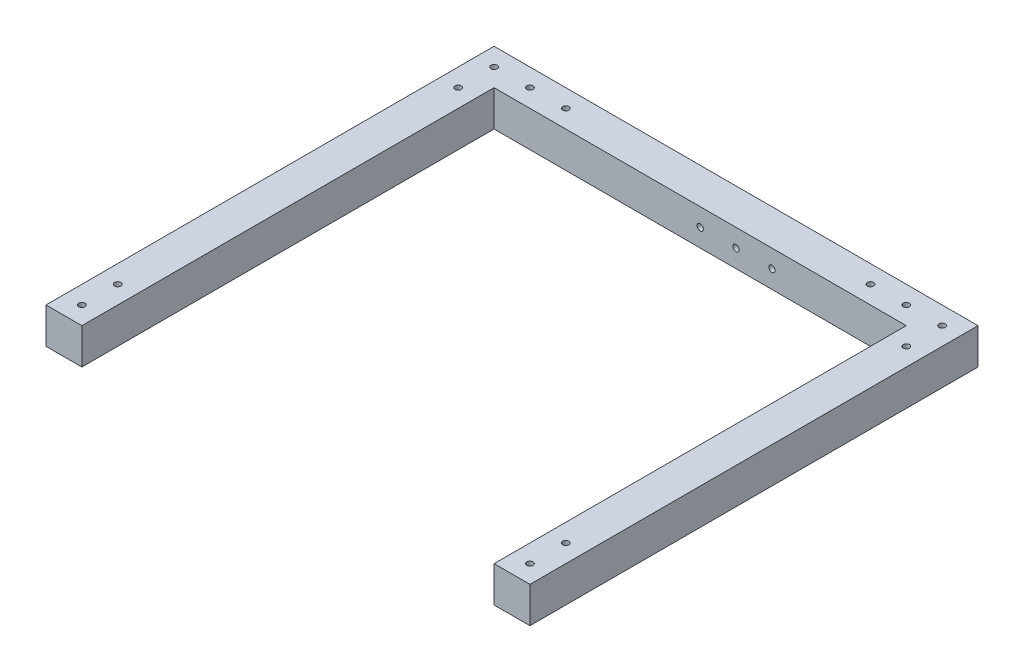
from build123d import *

# Parameters (mm, degrees)
SKETCH_1_W          = 270
SKETCH_1_H          = 20
SKETCH_1_W_2        = 20
SKETCH_1_H_2        = 230
EXTRUDE_1_DEPTH     = 20
CUT_EXTRUDE_1_REACH = 278.089
SKETCH_2_R          = 1.75
CUT_EXTRUDE_2_REACH = 286.825
SKETCH_3_R          = 1.75


with BuildPart() as part:
    # 草图1 → 凸台-拉伸1 (new body)
    with BuildSketch(Plane(origin=(0, 0, 0), x_dir=(1, 0, 0), z_dir=(0, 1, 0))):
        Rectangle(SKETCH_1_W, SKETCH_1_H)
        with Locations((-125, -125)):
            Rectangle(SKETCH_1_W_2, SKETCH_1_H_2)
        with Locations((125, -125)):
            Rectangle(SKETCH_1_W_2, SKETCH_1_H_2)
    extrude(amount=EXTRUDE_1_DEPTH)

    # 草图2 → 切除-拉伸1 (cut, up to next)
    with BuildSketch(Plane(origin=(0, 20, 0), x_dir=(1, 0, 0), z_dir=(0, 1, 0)), mode=Mode.PRIVATE) as cut_extrude_1_sk1:
        with Locations(Location((-125, 0, 0), (0, 0, 270))):
            Circle(SKETCH_2_R)
    cut_extrude_1_tool1 = extrude(cut_extrude_1_sk1.sketch, amount=-CUT_EXTRUDE_1_REACH, mode=Mode.PRIVATE) & part.part
    # 草图2 → 切除-拉伸1 (cut, up to next)
    with BuildSketch(Plane(origin=(0, 20, 0), x_dir=(1, 0, 0), z_dir=(0, 1, 0)), mode=Mode.PRIVATE) as cut_extrude_1_sk2:
        with Locations(Location((-125, -20, 0), (0, 0, 270))):
            Circle(SKETCH_2_R)
    cut_extrude_1_tool2 = extrude(cut_extrude_1_sk2.sketch, amount=-CUT_EXTRUDE_1_REACH, mode=Mode.PRIVATE) & part.part
    # 草图2 → 切除-拉伸1 (cut, up to next)
    with BuildSketch(Plane(origin=(0, 20, 0), x_dir=(1, 0, 0), z_dir=(0, 1, 0)), mode=Mode.PRIVATE) as cut_extrude_1_sk3:
        with Locations(Location((-105, 0, 0), (0, 0, 270))):
            Circle(SKETCH_2_R)
    cut_extrude_1_tool3 = extrude(cut_extrude_1_sk3.sketch, amount=-CUT_EXTRUDE_1_REACH, mode=Mode.PRIVATE) & part.part
    # 草图2 → 切除-拉伸1 (cut, up to next)
    with BuildSketch(Plane(origin=(0, 20, 0), x_dir=(1, 0, 0), z_dir=(0, 1, 0)), mode=Mode.PRIVATE) as cut_extrude_1_sk4:
        with Locations(Location((-125, -210, 0), (0, 0, 270))):
            Circle(SKETCH_2_R)
    cut_extrude_1_tool4 = extrude(cut_extrude_1_sk4.sketch, amount=-CUT_EXTRUDE_1_REACH, mode=Mode.PRIVATE) & part.part
    # 草图2 → 切除-拉伸1 (cut, up to next)
    with BuildSketch(Plane(origin=(0, 20, 0), x_dir=(1, 0, 0), z_dir=(0, 1, 0)), mode=Mode.PRIVATE) as cut_extrude_1_sk5:
        with Locations(Location((-125, -230, 0), (0, 0, 270))):
            Circle(SKETCH_2_R)
    cut_extrude_1_tool5 = extrude(cut_extrude_1_sk5.sketch, amount=-CUT_EXTRUDE_1_REACH, mode=Mode.PRIVATE) & part.part
    # 草图2 → 切除-拉伸1 (cut, up to next)
    with BuildSketch(Plane(origin=(0, 20, 0), x_dir=(1, 0, 0), z_dir=(0, 1, 0)), mode=Mode.PRIVATE) as cut_extrude_1_sk6:
        with Locations(Location((125, -210, 0), (0, 0, 270))):
            Circle(SKETCH_2_R)
    cut_extrude_1_tool6 = extrude(cut_extrude_1_sk6.sketch, amount=-CUT_EXTRUDE_1_REACH, mode=Mode.PRIVATE) & part.part
    # 草图2 → 切除-拉伸1 (cut, up to next)
    with BuildSketch(Plane(origin=(0, 20, 0), x_dir=(1, 0, 0), z_dir=(0, 1, 0)), mode=Mode.PRIVATE) as cut_extrude_1_sk7:
        with Locations(Location((125, -230, 0), (0, 0, 270))):
            Circle(SKETCH_2_R)
    cut_extrude_1_tool7 = extrude(cut_extrude_1_sk7.sketch, amount=-CUT_EXTRUDE_1_REACH, mode=Mode.PRIVATE) & part.part
    # 草图2 → 切除-拉伸1 (cut, up to next)
    with BuildSketch(Plane(origin=(0, 20, 0), x_dir=(1, 0, 0), z_dir=(0, 1, 0)), mode=Mode.PRIVATE) as cut_extrude_1_sk8:
        with Locations(Location((125, 0, 0), (0, 0, 270))):
            Circle(SKETCH_2_R)
    cut_extrude_1_tool8 = extrude(cut_extrude_1_sk8.sketch, amount=-CUT_EXTRUDE_1_REACH, mode=Mode.PRIVATE) & part.part
    # 草图2 → 切除-拉伸1 (cut, up to next)
    with BuildSketch(Plane(origin=(0, 20, 0), x_dir=(1, 0, 0), z_dir=(0, 1, 0)), mode=Mode.PRIVATE) as cut_extrude_1_sk9:
        with Locations(Location((125, -20, 0), (0, 0, 270))):
            Circle(SKETCH_2_R)
    cut_extrude_1_tool9 = extrude(cut_extrude_1_sk9.sketch, amount=-CUT_EXTRUDE_1_REACH, mode=Mode.PRIVATE) & part.part
    # 草图2 → 切除-拉伸1 (cut, up to next)
    with BuildSketch(Plane(origin=(0, 20, 0), x_dir=(1, 0, 0), z_dir=(0, 1, 0)), mode=Mode.PRIVATE) as cut_extrude_1_sk10:
        with Locations(Location((105, 0, 0), (0, 0, 270))):
            Circle(SKETCH_2_R)
    cut_extrude_1_tool10 = extrude(cut_extrude_1_sk10.sketch, amount=-CUT_EXTRUDE_1_REACH, mode=Mode.PRIVATE) & part.part
    # 草图2 → 切除-拉伸1 (cut, up to next)
    with BuildSketch(Plane(origin=(0, 20, 0), x_dir=(1, 0, 0), z_dir=(0, 1, 0)), mode=Mode.PRIVATE) as cut_extrude_1_sk11:
        with Locations(Location((85, 0, 0), (0, 0, 270))):
            Circle(SKETCH_2_R)
    cut_extrude_1_tool11 = extrude(cut_extrude_1_sk11.sketch, amount=-CUT_EXTRUDE_1_REACH, mode=Mode.PRIVATE) & part.part
    # 草图2 → 切除-拉伸1 (cut, up to next)
    with BuildSketch(Plane(origin=(0, 20, 0), x_dir=(1, 0, 0), z_dir=(0, 1, 0)), mode=Mode.PRIVATE) as cut_extrude_1_sk12:
        with Locations(Location((-85, 0, 0), (0, 0, 270))):
            Circle(SKETCH_2_R)
    cut_extrude_1_tool12 = extrude(cut_extrude_1_sk12.sketch, amount=-CUT_EXTRUDE_1_REACH, mode=Mode.PRIVATE) & part.part
    add(cut_extrude_1_tool1.solids().sort_by_distance((-125, 20, 0))[0], mode=Mode.SUBTRACT)
    add(cut_extrude_1_tool2.solids().sort_by_distance((-125, 20, 20))[0], mode=Mode.SUBTRACT)
    add(cut_extrude_1_tool3.solids().sort_by_distance((-105, 20, 0))[0], mode=Mode.SUBTRACT)
    add(cut_extrude_1_tool4.solids().sort_by_distance((-125, 20, 210))[0], mode=Mode.SUBTRACT)
    add(cut_extrude_1_tool5.solids().sort_by_distance((-125, 20, 230))[0], mode=Mode.SUBTRACT)
    add(cut_extrude_1_tool6.solids().sort_by_distance((125, 20, 210))[0], mode=Mode.SUBTRACT)
    add(cut_extrude_1_tool7.solids().sort_by_distance((125, 20, 230))[0], mode=Mode.SUBTRACT)
    add(cut_extrude_1_tool8.solids().sort_by_distance((125, 20, 0))[0], mode=Mode.SUBTRACT)
    add(cut_extrude_1_tool9.solids().sort_by_distance((125, 20, 20))[0], mode=Mode.SUBTRACT)
    add(cut_extrude_1_tool10.solids().sort_by_distance((105, 20, 0))[0], mode=Mode.SUBTRACT)
    add(cut_extrude_1_tool11.solids().sort_by_distance((85, 20, 0))[0], mode=Mode.SUBTRACT)
    add(cut_extrude_1_tool12.solids().sort_by_distance((-85, 20, 0))[0], mode=Mode.SUBTRACT)

    # 草图3 → 切除-拉伸2 (cut, up to next)
    with BuildSketch(Plane(origin=(0, 0, -10), x_dir=(-1, 0, 0), z_dir=(0, 0, -1)), mode=Mode.PRIVATE) as cut_extrude_2_sk1:
        with Locations((-20, 10)):
            Circle(SKETCH_3_R)
    cut_extrude_2_tool1 = extrude(cut_extrude_2_sk1.sketch, amount=-CUT_EXTRUDE_2_REACH, mode=Mode.PRIVATE) & part.part
    # 草图3 → 切除-拉伸2 (cut, up to next)
    with BuildSketch(Plane(origin=(0, 0, -10), x_dir=(-1, 0, 0), z_dir=(0, 0, -1)), mode=Mode.PRIVATE) as cut_extrude_2_sk2:
        with Locations((0, 10)):
            Circle(SKETCH_3_R)
    cut_extrude_2_tool2 = extrude(cut_extrude_2_sk2.sketch, amount=-CUT_EXTRUDE_2_REACH, mode=Mode.PRIVATE) & part.part
    # 草图3 → 切除-拉伸2 (cut, up to next)
    with BuildSketch(Plane(origin=(0, 0, -10), x_dir=(-1, 0, 0), z_dir=(0, 0, -1)), mode=Mode.PRIVATE) as cut_extrude_2_sk3:
        with Locations((-40, 10)):
            Circle(SKETCH_3_R)
    cut_extrude_2_tool3 = extrude(cut_extrude_2_sk3.sketch, amount=-CUT_EXTRUDE_2_REACH, mode=Mode.PRIVATE) & part.part
    add(cut_extrude_2_tool1.solids().sort_by_distance((20, 10, -10))[0], mode=Mode.SUBTRACT)
    add(cut_extrude_2_tool2.solids().sort_by_distance((0, 10, -10))[0], mode=Mode.SUBTRACT)
    add(cut_extrude_2_tool3.solids().sort_by_distance((40, 10, -10))[0], mode=Mode.SUBTRACT)


solid = part.part
